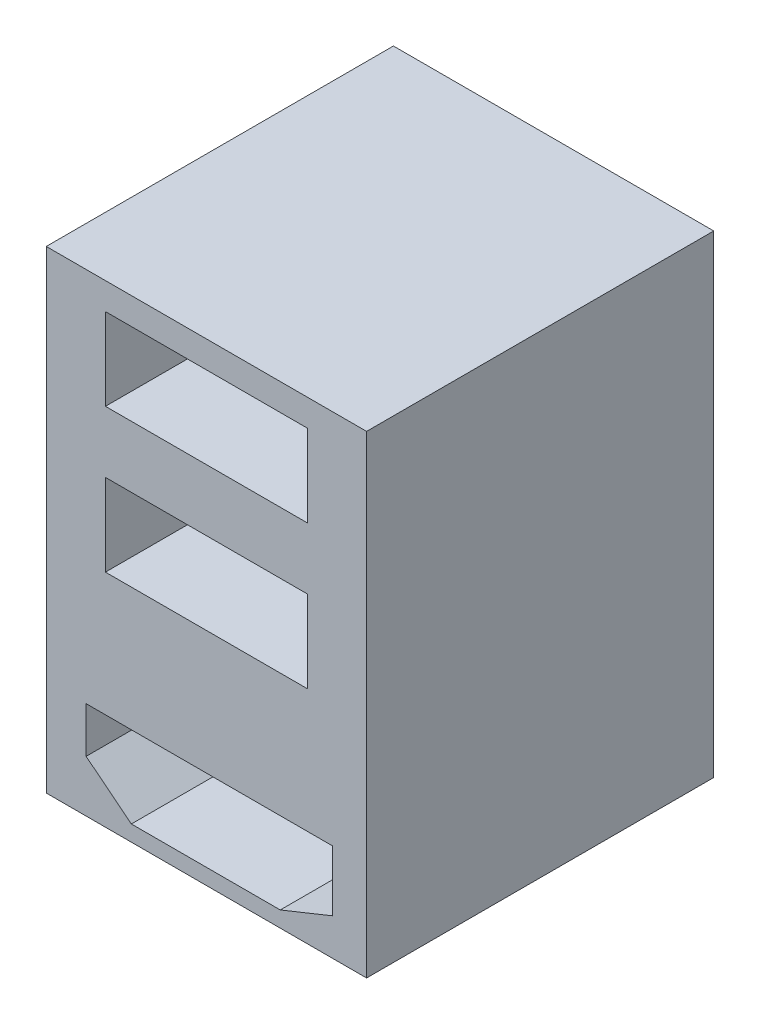
from build123d import *

# Parameters (mm, degrees)
SKETCH_1_W      = 20.3
SKETCH_1_H      = 30
SKETCH_1_W_2    = 12.8
SKETCH_1_H_2    = 5.2
EXTRUDE_1_DEPTH = 10
SKETCH_2_W      = 20.3
SKETCH_2_H      = 30
EXTRUDE_2_DEPTH = 12


with BuildPart() as part:
    # Эскиз1 → Бобышка-Вытянуть1 (new body)
    with BuildSketch(Plane.XY):
        with Locations((124.886360731, 91.960324966)):
            Rectangle(SKETCH_1_W, SKETCH_1_H)
        with Locations((124.886360731, 93.560324966)):
            Rectangle(SKETCH_1_W_2, SKETCH_1_H_2, mode=Mode.SUBTRACT)
        with Locations((124.886360731, 102.660324966)):
            Rectangle(SKETCH_1_W_2, SKETCH_1_H_2, mode=Mode.SUBTRACT)
        Polygon((129.566618584, 77.960324966), (120.129531537, 77.960324966), (117.26298197, 80.238017172), (117.26298197, 83.13068263), (132.886839219, 83.13068263), (132.886839219, 79.296578456), align=None, mode=Mode.SUBTRACT)
    extrude(amount=-EXTRUDE_1_DEPTH)

    # Эскиз2 → Бобышка-Вытянуть2 (add)
    with BuildSketch(Plane(origin=(0, 0, -10), x_dir=(-1, 0, 0), z_dir=(0, 0, -1))):
        with Locations((-124.886360731, 91.960324966)):
            Rectangle(SKETCH_2_W, SKETCH_2_H)
    extrude(amount=EXTRUDE_2_DEPTH)


solid = part.part
